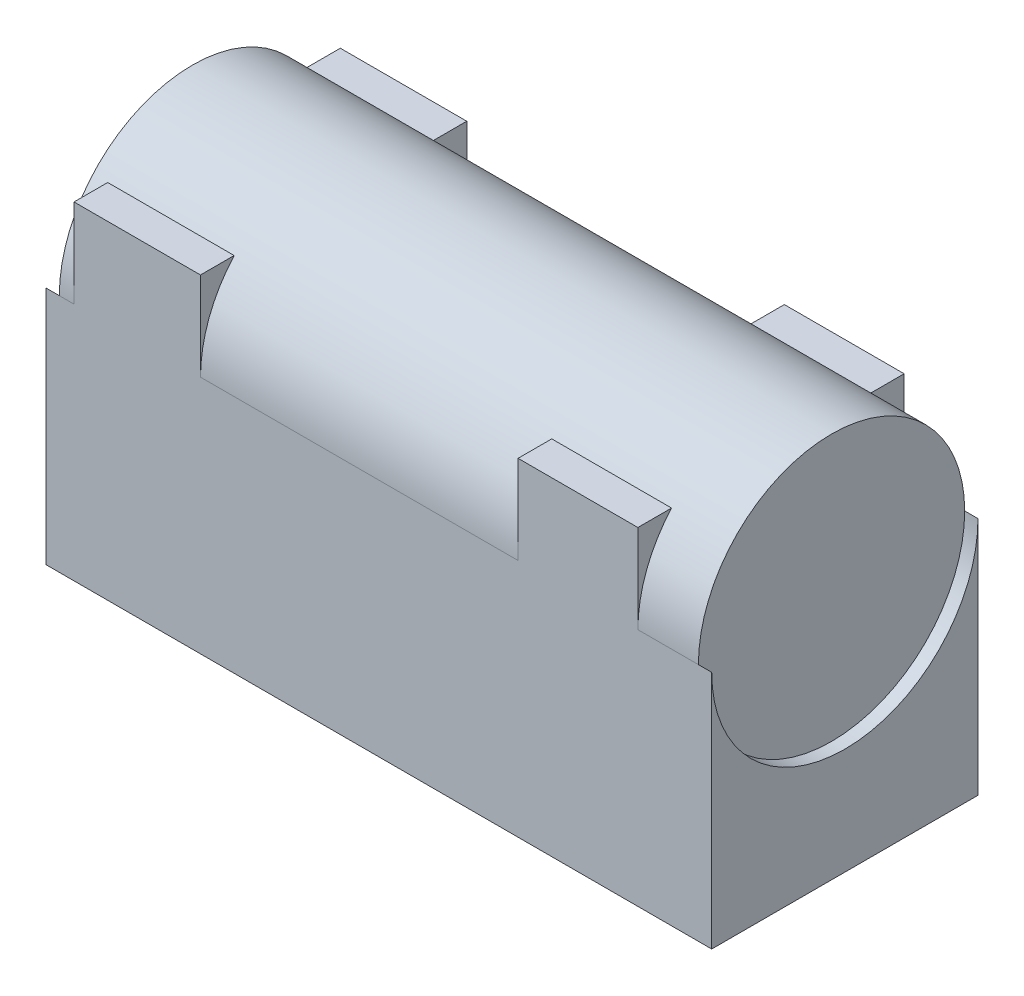
from build123d import *

# Parameters (mm, degrees)
BOSS_EXTRUDE1_DEPTH = 12.5
BOSS_EXTRUDE2_DEPTH = 12
SKETCH2_W           = 4.747951262
SKETCH2_H           = 6.647569448
SKETCH2_W_2         = 4.499129778
BOSS_EXTRUDE3_DEPTH = 10


with BuildPart() as part:
    # Sketch1 → Boss-Extrude1 (new, symmetric)
    with BuildSketch(Plane(origin=(0, 0, 0), x_dir=(0, 0, -1), z_dir=(1, 0, 0))):
        with BuildLine():
            Line((5, 0), (-5, 0))
            Line((-5, 0), (-5, 3))
            Line((-5, 3), (-5, 9))
            ThreePointArc((-5, 9), (0, 4), (5, 9))
            Line((5, 9), (5, 3))
            Line((5, 3), (5, 0))
        make_face()
    extrude(amount=BOSS_EXTRUDE1_DEPTH, both=True)

    # Sketch1<5> → Boss-Extrude2 (add, symmetric)
    with BuildSketch(Plane(origin=(0, 0, 0), x_dir=(0, 0, -1), z_dir=(1, 0, 0))):
        with BuildLine():
            ThreePointArc((-5, 9), (-3.535533906, 5.464466094), (0, 4))
            ThreePointArc((0, 4), (3.535533906, 5.464466094), (5, 9))
            ThreePointArc((5, 9), (0, 14), (-5, 9))
        make_face()
    extrude(amount=BOSS_EXTRUDE2_DEPTH, both=True)

    # Sketch2 → Boss-Extrude3 (add)
    with BuildSketch(Plane.XY.offset(5)):
        with Locations((-9.073174039, 9)):
            Rectangle(SKETCH2_W, SKETCH2_H)
        with Locations((7.477413935, 9)):
            Rectangle(SKETCH2_W_2, SKETCH2_H)
    extrude(amount=-BOSS_EXTRUDE3_DEPTH)


solid = part.part
